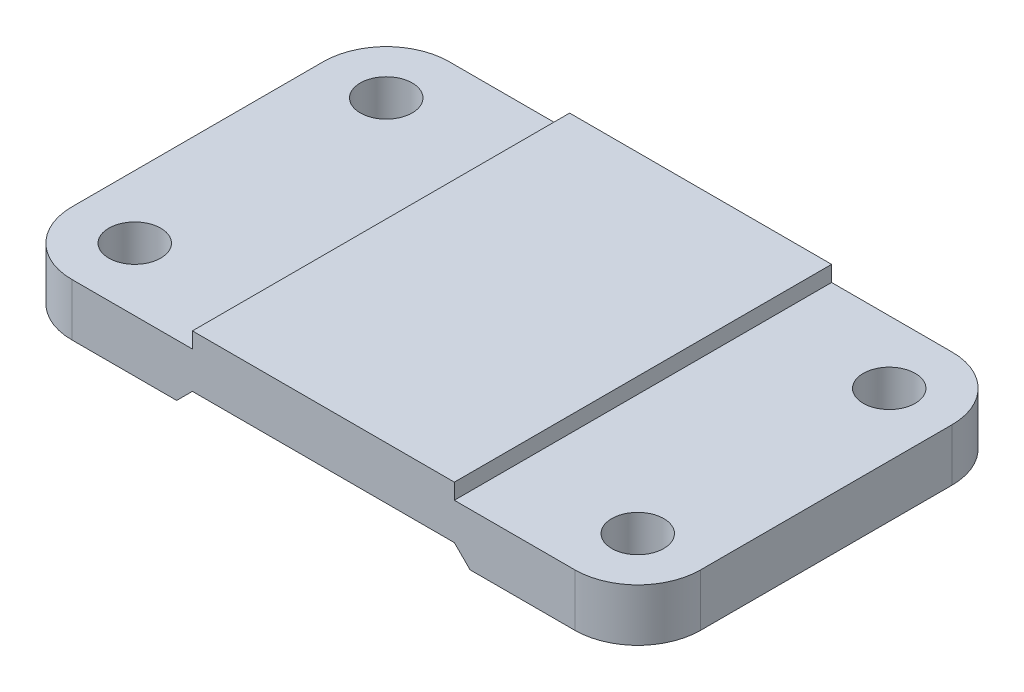
from build123d import *

# Parameters (mm, degrees)
SKETCH1_W           = 120
SKETCH1_H           = 72
SKETCH1_R           = 4.95970326
BOSS_EXTRUDE1_DEPTH = 10
FILLET1_R           = 12
CUT_EXTRUDE1_DEPTH  = 73
SKETCH3_W           = 50
SKETCH3_H           = 72
BOSS_EXTRUDE2_DEPTH = 3


with BuildPart() as part:
    # Sketch1 → Boss-Extrude1 (new body)
    with BuildSketch(Plane(origin=(0, 0, 0), x_dir=(1, 0, 0), z_dir=(0, 1, 0))):
        Rectangle(SKETCH1_W, SKETCH1_H)
        with Locations(Location((-48, 24, 0), (0, 0, 270))):
            Circle(SKETCH1_R, mode=Mode.SUBTRACT)
        with Locations(Location((48, 24, 0), (0, 0, 90))):
            Circle(SKETCH1_R, mode=Mode.SUBTRACT)
        with Locations(Location((48, -24, 0), (0, 0, 270))):
            Circle(SKETCH1_R, mode=Mode.SUBTRACT)
        with Locations(Location((-48, -24, 0), (0, 0, 90))):
            Circle(SKETCH1_R, mode=Mode.SUBTRACT)
    extrude(amount=BOSS_EXTRUDE1_DEPTH)

    # Fillet1
    fillet1_edges = [part.edges().sort_by_distance(p)[0] for p in [
        (60, 5, 36),
        (-60, 5, 36),
        (-60, 5, -36),
        (60, 5, -36),
    ]]
    fillet(fillet1_edges, radius=FILLET1_R)

    # Sketch2 → Cut-Extrude1 (cut)
    with BuildSketch(Plane.XY.offset(36)):
        Polygon((-28, 0), (0, 0), (0, 3), (-25, 3), align=None)
        Polygon((0, 3), (0, 0), (28, 0), (25, 3), align=None)
    extrude(amount=-CUT_EXTRUDE1_DEPTH, mode=Mode.SUBTRACT)

    # Sketch3 → Boss-Extrude2 (add)
    with BuildSketch(Plane(origin=(0, 10, 0), x_dir=(1, 0, 0), z_dir=(0, 1, 0))):
        Rectangle(SKETCH3_W, SKETCH3_H)
    extrude(amount=BOSS_EXTRUDE2_DEPTH)


solid = part.part
